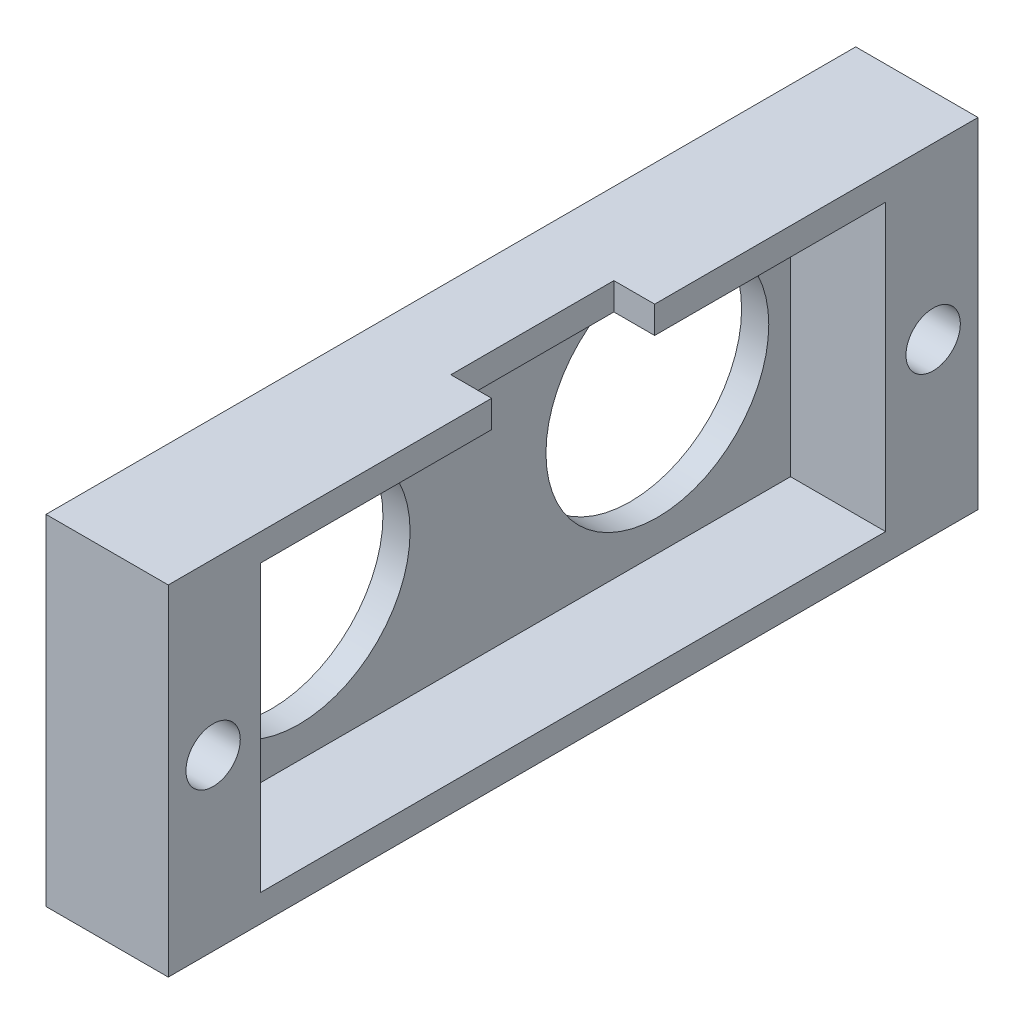
from build123d import *

# Parameters (mm, degrees)
SKETCH1_R               = 2
SKETCH1_R_2             = 8.2
BOSS_EXTRUDE1_DEPTH     = 2
SKETCH3_W               = 59.6
SKETCH3_H               = 25
SKETCH3_R               = 2
SKETCH3_W_2             = 46
SKETCH3_H_2             = 21
BOSS_EXTRUDE3_DEPTH     = 7
CUT_EXTRUDE1_DEPTH      = 40.925430492
CUT_EXTRUDE1_DEPTH_BACK = 3


with BuildPart() as part:
    # Sketch1 → Boss-Extrude1 (new body)
    with BuildSketch(Plane(origin=(0, 0, 0), x_dir=(0, 0, -1), z_dir=(1, 0, 0))):
        Polygon((25, 12.5), (-25, 12.5), (-29.8, 12.5), (-29.8, -12.5), (-25, -12.5), (25, -12.5), (29.8, -12.5), (29.8, 12.5), align=None)
        with Locations((-26.5, 0)):
            Circle(SKETCH1_R, mode=Mode.SUBTRACT)
        with Locations((-13.2, 0)):
            Circle(SKETCH1_R_2, mode=Mode.SUBTRACT)
        with Locations((13.2, 0)):
            Circle(SKETCH1_R_2, mode=Mode.SUBTRACT)
        with Locations((26.5, 0)):
            Circle(SKETCH1_R, mode=Mode.SUBTRACT)
    extrude(amount=BOSS_EXTRUDE1_DEPTH)

    # Sketch3 → Boss-Extrude3 (add)
    with BuildSketch(Plane(origin=(2, 0, 0), x_dir=(0, 0, -1), z_dir=(1, 0, 0))):
        Rectangle(SKETCH3_W, SKETCH3_H)
        with Locations((-26.5, 0)):
            Circle(SKETCH3_R, mode=Mode.SUBTRACT)
        with Locations((26.5, 0)):
            Circle(SKETCH3_R, mode=Mode.SUBTRACT)
        Rectangle(SKETCH3_W_2, SKETCH3_H_2, mode=Mode.SUBTRACT)
    extrude(amount=BOSS_EXTRUDE3_DEPTH)

    # Sketch5 → Cut-Extrude1 (cut, two sides: drawn at the far end of the back side and taken through both)
    with BuildSketch(Plane(origin=(0, 12.5, 0), x_dir=(1, 0, 0), z_dir=(0, 1, 0)).offset(-CUT_EXTRUDE1_DEPTH_BACK)):
        Polygon((92.827908002, 6), (9, 6), (6, 6), (6, -6), (9, -6), (92.827908002, -6), (260.483724007, -6), (260.483724007, 6), align=None)
    extrude(amount=CUT_EXTRUDE1_DEPTH + CUT_EXTRUDE1_DEPTH_BACK, mode=Mode.SUBTRACT)


solid = part.part
